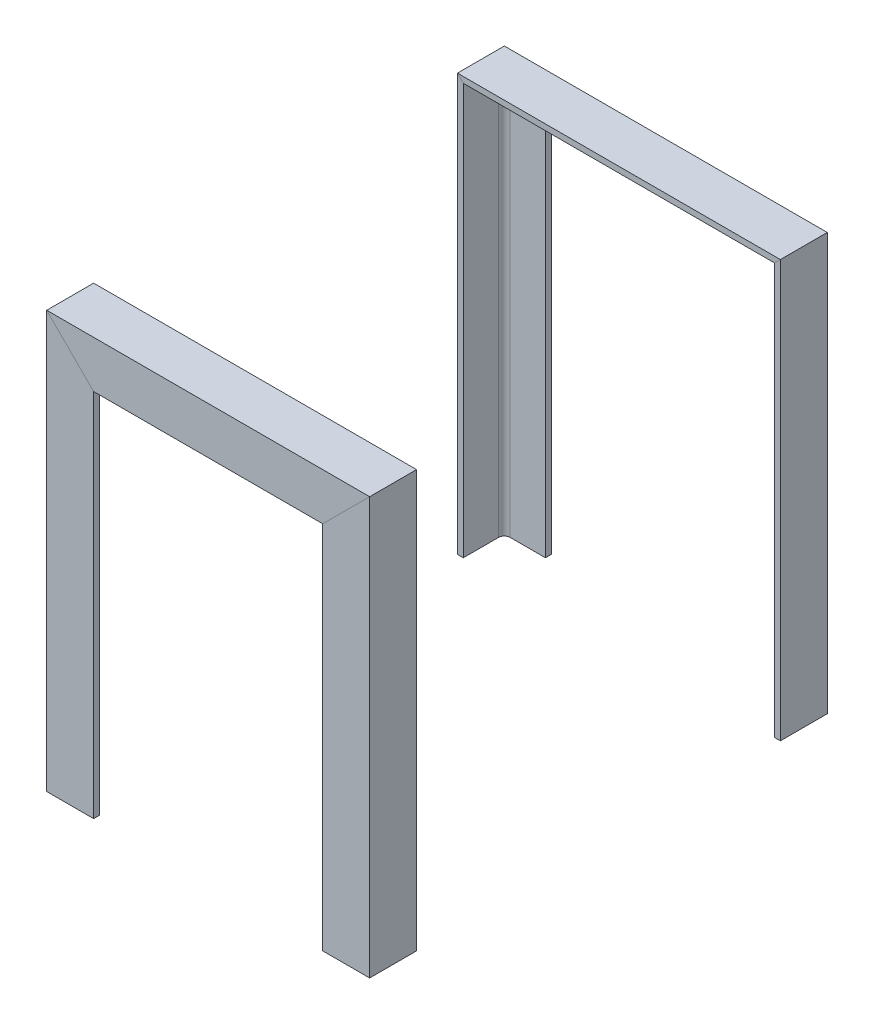
from build123d import *

# Parameters (mm, degrees)
NGULO_DE_EXTREMOS_CUADRADOS_AL_LS_AL_LS_DEPTH       = 262.473024484
NGULO_DE_EXTREMOS_CUADRADOS_AL_LS_AL_3_DEPTH        = 248.594048969
NGULO_DE_EXTREMOS_CUADRADOS_AL_LS_AL_5_DEPTH        = 262.473024484
NGULO_DE_EXTREMOS_CUADRADOS_AL_LS_AL_6_DEPTH        = 262.473024484
NGULO_DE_EXTREMOS_CUADRADOS_AL_LS_AL_6_2_DEPTH      = 248.594048969
NGULO_DE_EXTREMOS_CUADRADOS_AL_LS_AL_6_3_DEPTH      = 36.921024484
NGULO_DE_EXTREMOS_CUADRADOS_AL_LS_AL_6_3_DEPTH_BACK = 225.552


with BuildPart() as part:
    # Sketch1 → ngulo de extremos cuadrados al ls AL LS (new body)
    with BuildSketch(Plane.XZ):
        with BuildLine():
            Line((0, 0), (0, 25.4))
            Line((0, 25.4), (3.175, 25.4))
            Line((3.175, 25.4), (3.175, 6.35))
            ThreePointArc((3.175, 6.35), (4.10493597, 4.10493597), (6.35, 3.175))
            Line((6.35, 3.175), (25.4, 3.175))
            Line((25.4, 3.175), (25.4, 0))
            Line((25.4, 0), (0, 0))
        make_face()
    extrude(amount=-NGULO_DE_EXTREMOS_CUADRADOS_AL_LS_AL_LS_DEPTH)

    # ngulo de extremos cuadrados al ls AL 2
    split(bisect_by=Plane(origin=(0, 225.552, 0), x_dir=(0.707106781, -0.707106781, 0), z_dir=(-0.707106781, -0.707106781, 0)), keep=Keep.TOP)


with BuildPart() as body_2:
    # Sketch1 on segment 2 (carried to segment 2) → ngulo de extremos cuadrados al ls AL 3 (new body)
    with BuildSketch(Plane(origin=(211.673024484, 225.552, 0), x_dir=(0, -1, 0), z_dir=(-1, 0, 0))):
        with BuildLine():
            Line((0, 0), (0, 25.4))
            Line((0, 25.4), (3.175, 25.4))
            Line((3.175, 25.4), (3.175, 6.35))
            ThreePointArc((3.175, 6.35), (4.10493597, 4.10493597), (6.35, 3.175))
            Line((6.35, 3.175), (25.4, 3.175))
            Line((25.4, 3.175), (25.4, 0))
            Line((25.4, 0), (0, 0))
        make_face()
    extrude(amount=NGULO_DE_EXTREMOS_CUADRADOS_AL_LS_AL_3_DEPTH)

    # ngulo de extremos cuadrados al ls AL 3 m
    split(bisect_by=Plane(origin=(0, 225.552, 0), x_dir=(-0.707106781, 0.707106781, 0), z_dir=(0.707106781, 0.707106781, 0)), keep=Keep.TOP)

    # ngulo de extremos cuadrados al ls AL 4
    split(bisect_by=Plane(origin=(174.752, 225.552, 0), x_dir=(-0.707106781, -0.707106781, 0), z_dir=(-0.707106781, 0.707106781, 0)), keep=Keep.TOP)


with BuildPart() as body_3:
    # Sketch1 on segment 3 (carried to segment 3) → ngulo de extremos cuadrados al ls AL 5 (new body)
    with BuildSketch(Plane(origin=(174.752, 0, 0), x_dir=(-1, 0, 0), z_dir=(0, 1, 0))):
        with BuildLine():
            Line((0, 0), (0, 25.4))
            Line((0, 25.4), (3.175, 25.4))
            Line((3.175, 25.4), (3.175, 6.35))
            ThreePointArc((3.175, 6.35), (4.10493597, 4.10493597), (6.35, 3.175))
            Line((6.35, 3.175), (25.4, 3.175))
            Line((25.4, 3.175), (25.4, 0))
            Line((25.4, 0), (0, 0))
        make_face()
    extrude(amount=NGULO_DE_EXTREMOS_CUADRADOS_AL_LS_AL_5_DEPTH)

    # ngulo de extremos cuadrados al ls AL 5 m
    split(bisect_by=Plane(origin=(174.752, 225.552, 0), x_dir=(0.707106781, 0.707106781, 0), z_dir=(0.707106781, -0.707106781, 0)), keep=Keep.TOP)


with BuildPart() as body_4:
    # Sketch12 on segment 1 (carried to segment 1) → ngulo de extremos cuadrados al ls AL 6 (new body)
    with BuildSketch(Plane(origin=(0, 262.473024484, 247.65), x_dir=(0, 0, -1), z_dir=(0, -1, 0))):
        with BuildLine():
            Line((0, 0), (0, 25.4))
            Line((0, 25.4), (3.175, 25.4))
            Line((3.175, 25.4), (3.175, 6.35))
            ThreePointArc((3.175, 6.35), (4.10493597, 4.10493597), (6.35, 3.175))
            Line((6.35, 3.175), (25.4, 3.175))
            Line((25.4, 3.175), (25.4, 0))
            Line((25.4, 0), (0, 0))
        make_face()
    extrude(amount=NGULO_DE_EXTREMOS_CUADRADOS_AL_LS_AL_6_DEPTH)

    # ngulo de extremos cuadrados al ls AL 6 m
    split(bisect_by=Plane(origin=(0, 225.552, 247.65), x_dir=(0.707106781, -0.707106781, 0), z_dir=(-0.707106781, -0.707106781, 0)), keep=Keep.TOP)


with BuildPart() as body_5:
    # Sketch12 on segment 2 (carried to segment 2) → ngulo de extremos cuadrados al ls AL 6 2 (new body)
    with BuildSketch(Plane(origin=(211.673024484, 225.552, 247.65), x_dir=(0, 0, -1), z_dir=(-1, 0, 0))):
        with BuildLine():
            Line((0, 0), (0, 25.4))
            Line((0, 25.4), (3.175, 25.4))
            Line((3.175, 25.4), (3.175, 6.35))
            ThreePointArc((3.175, 6.35), (4.10493597, 4.10493597), (6.35, 3.175))
            Line((6.35, 3.175), (25.4, 3.175))
            Line((25.4, 3.175), (25.4, 0))
            Line((25.4, 0), (0, 0))
        make_face()
    extrude(amount=NGULO_DE_EXTREMOS_CUADRADOS_AL_LS_AL_6_2_DEPTH)

    # ngulo de extremos cuadrados al ls AL 7
    split(bisect_by=Plane(origin=(0, 225.552, 247.65), x_dir=(-0.707106781, 0.707106781, 0), z_dir=(0.707106781, 0.707106781, 0)), keep=Keep.TOP)

    # ngulo de extremos cuadrados al ls AL 8
    split(bisect_by=Plane(origin=(174.752, 225.552, 247.65), x_dir=(-0.707106781, -0.707106781, 0), z_dir=(-0.707106781, 0.707106781, 0)), keep=Keep.TOP)


with BuildPart() as body_6:
    # Sketch12 → ngulo de extremos cuadrados al ls AL 6 3 (new, two sides: drawn at the far end of the back side and taken through both)
    with BuildSketch(Plane(origin=(174.752, 225.552, 247.65), x_dir=(0, 0, -1), z_dir=(0, 1, 0)).offset(-NGULO_DE_EXTREMOS_CUADRADOS_AL_LS_AL_6_3_DEPTH_BACK)):
        with BuildLine():
            Line((0, 0), (0, 25.4))
            Line((0, 25.4), (3.175, 25.4))
            Line((3.175, 25.4), (3.175, 6.35))
            ThreePointArc((3.175, 6.35), (4.10493597, 4.10493597), (6.35, 3.175))
            Line((6.35, 3.175), (25.4, 3.175))
            Line((25.4, 3.175), (25.4, 0))
            Line((25.4, 0), (0, 0))
        make_face()
    extrude(amount=NGULO_DE_EXTREMOS_CUADRADOS_AL_LS_AL_6_3_DEPTH + NGULO_DE_EXTREMOS_CUADRADOS_AL_LS_AL_6_3_DEPTH_BACK)

    # ngulo de extremos cuadrados al ls AL 9
    split(bisect_by=Plane(origin=(174.752, 225.552, 247.65), x_dir=(0.707106781, 0.707106781, 0), z_dir=(0.707106781, -0.707106781, 0)), keep=Keep.TOP)


solid = Compound([part.part, body_2.part, body_3.part, body_4.part, body_5.part, body_6.part])
